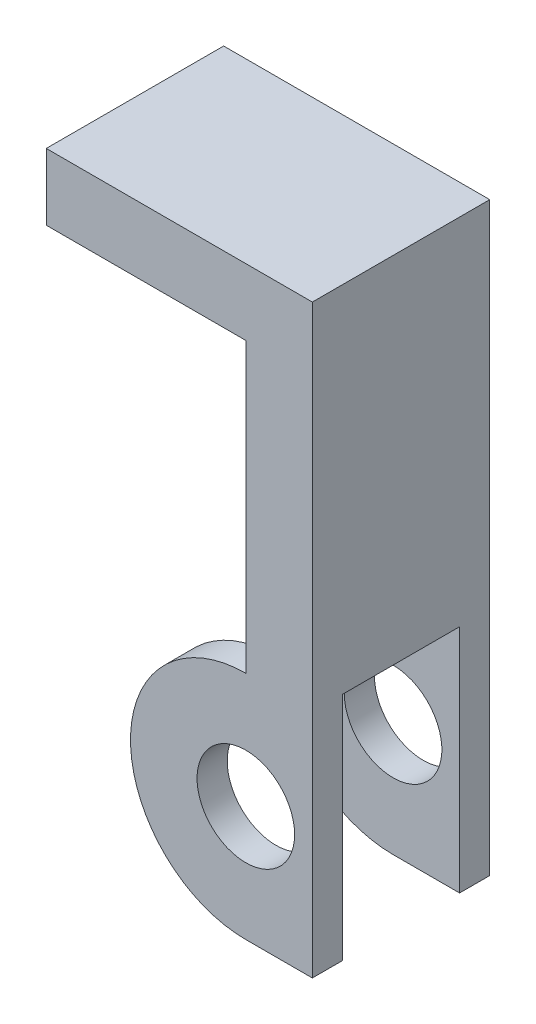
from build123d import *

# Parameters (mm, degrees)
SKETCH1_R           = 3.4925
BOSS_EXTRUDE1_DEPTH = 12.7
SKETCH2_W           = 25.4
SKETCH2_H           = 8.382
CUT_EXTRUDE1_DEPTH  = 16.51


with BuildPart() as part:
    # Sketch1 → Boss-Extrude1 (new body)
    with BuildSketch(Plane.XY):
        with BuildLine():
            Line((0, 0), (0, 25.4))
            Line((0, 25.4), (-19.05, 25.4))
            Line((-19.05, 25.4), (-19.05, 20.6375))
            Line((-19.05, 20.6375), (-4.7625, 20.6375))
            Line((-4.7625, 20.6375), (-4.7625, 0))
            ThreePointArc((-4.7625, 0), (-13.0175, -8.255), (-4.7625, -16.51))
            Line((-4.7625, -16.51), (0, -16.51))
            Line((0, -16.51), (0, 0))
        make_face()
        with Locations((-4.7625, -8.255)):
            Circle(SKETCH1_R, mode=Mode.SUBTRACT)
    extrude(amount=BOSS_EXTRUDE1_DEPTH)

    # Sketch2 → Cut-Extrude1 (cut)
    with BuildSketch(Plane.XZ.offset(16.51)):
        with Locations((-12.7, 6.35)):
            Rectangle(SKETCH2_W, SKETCH2_H)
    extrude(amount=-CUT_EXTRUDE1_DEPTH, mode=Mode.SUBTRACT)


solid = part.part
